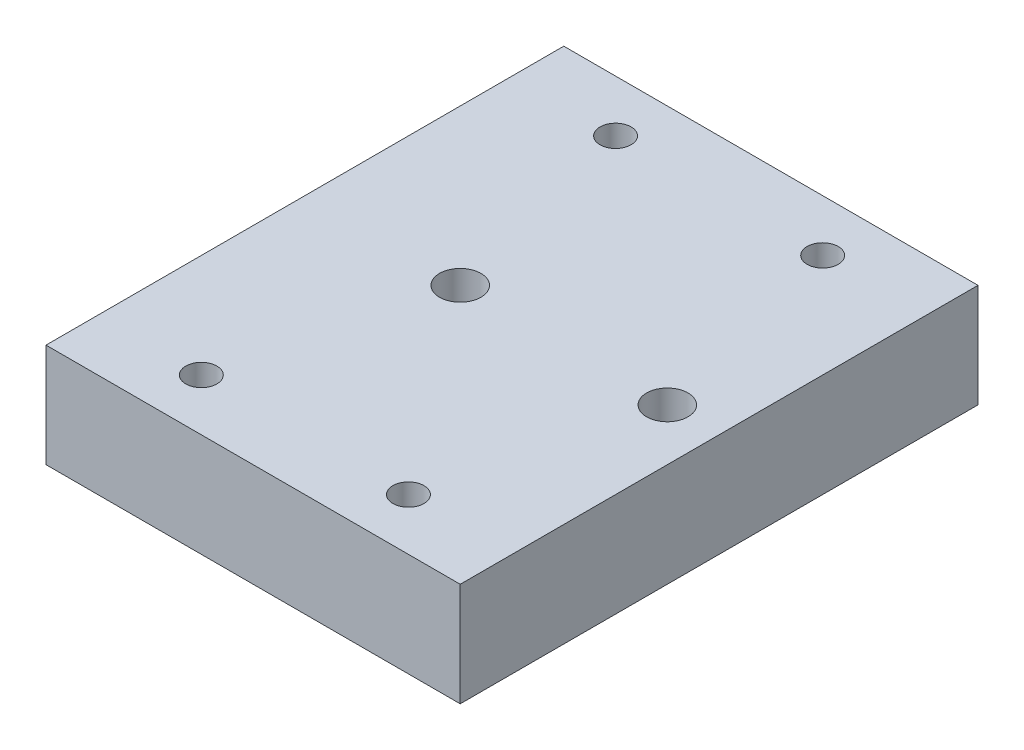
from build123d import *

# Parameters (mm, degrees)
SKETCH_1_W      = 80
SKETCH_1_H      = 100
SKETCH_1_R      = 3
SKETCH_1_R_2    = 4
EXTRUDE_1_DEPTH = 20


with BuildPart() as part:
    # Эскиз1 → Бобышка-Вытянуть1 (new body)
    with BuildSketch(Plane(origin=(0, 0, 0), x_dir=(1, 0, 0), z_dir=(0, 1, 0))):
        with Locations((40, 50)):
            Rectangle(SKETCH_1_W, SKETCH_1_H)
        with Locations(Location((20, 90, 0), (0, 0, 270))):
            Circle(SKETCH_1_R, mode=Mode.SUBTRACT)
        with Locations(Location((60, 90, 0), (0, 0, 270))):
            Circle(SKETCH_1_R, mode=Mode.SUBTRACT)
        with Locations(Location((20, 10, 0), (0, 0, 270))):
            Circle(SKETCH_1_R, mode=Mode.SUBTRACT)
        with Locations(Location((60, 10, 0), (0, 0, 270))):
            Circle(SKETCH_1_R, mode=Mode.SUBTRACT)
        with Locations(Location((30, 50, 0), (0, 0, 270))):
            Circle(SKETCH_1_R_2, mode=Mode.SUBTRACT)
        with Locations(Location((70, 50, 0), (0, 0, 270))):
            Circle(SKETCH_1_R_2, mode=Mode.SUBTRACT)
    extrude(amount=EXTRUDE_1_DEPTH)


solid = part.part
